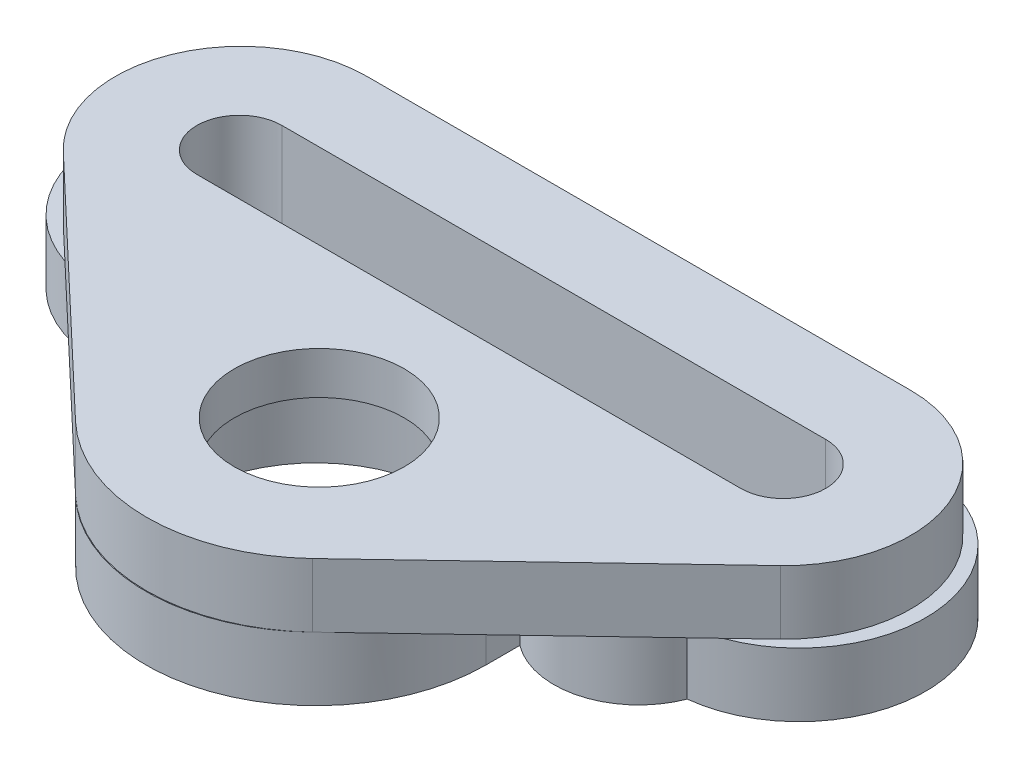
from build123d import *

# Parameters (mm, degrees)
SZKIC2_R                    = 7.5
SZKIC2_R_2                  = 2.4
DODANIE_WYCI_GNI_CIE1_DEPTH = 3.75
SZKIC3_R                    = 5
DODANIE_WYCI_GNI_CIE2_DEPTH = 3.75
SZKIC9_R                    = 7.5
WYTNIJ_WYCI_GNI_CIE3_DEPTH  = 5
SZKIC10_R                   = 2.5
WYTNIJ_WYCI_GNI_CIE4_DEPTH  = 6.5


with BuildPart() as part:
    # Szkic2 → Dodanie-wyciągnięcie1 (new body)
    with BuildSketch(Plane(origin=(0, 0, 0), x_dir=(1, 0, 0), z_dir=(0, 1, 0))):
        with BuildLine():
            Line((-16, 5), (16, 5))
            ThreePointArc((16, 5), (24.235849057, -1.575471698), (17.660377358, -9.811320755))
            ThreePointArc((17.660377358, -9.811320755), (14.373605639, -12.807619738), (10, -12))
            Line((10, -12), (10, -14))
            ThreePointArc((10, -14), (0, -24), (-10, -14))
            Line((-10, -14), (-10, -12.057627201))
            ThreePointArc((-10, -12.057627201), (-14.369651741, -12.856788302), (-17.67794965, -9.892386213))
            ThreePointArc((-17.67794965, -9.892386213), (-24.285167931, -1.607218282), (-16, 5))
        make_face()
        with Locations(Location((0, -14, 0), (0, 0, 270))):
            Circle(SZKIC2_R, mode=Mode.SUBTRACT)
        with Locations(Location((-13, -8, 0), (0, 0, 270))):
            Circle(SZKIC2_R_2, mode=Mode.SUBTRACT)
        with Locations(Location((13, -8, 0), (0, 0, 270))):
            Circle(SZKIC2_R_2, mode=Mode.SUBTRACT)
        with BuildLine():
            Line((-16, 0), (16, 0))
            ThreePointArc((16, 0), (18.5, -2.5), (16, -5))
            Line((16, -5), (-16, -5))
            ThreePointArc((-16, -5), (-18.5, -2.5), (-16, 0))
        make_face(mode=Mode.SUBTRACT)
    extrude(amount=DODANIE_WYCI_GNI_CIE1_DEPTH)

    # Szkic3 → Dodanie-wyciągnięcie2 (add)
    with BuildSketch(Plane(origin=(0, 3.75, 0), x_dir=(1, 0, 0), z_dir=(0, 1, 0))):
        with BuildLine():
            Line((-16, 5), (16, 5))
            ThreePointArc((16, 5), (22.873192437, 0.342120663), (21.093817027, -7.76777683))
            Line((21.093817027, -7.76777683), (6.968542539, -21.17212764))
            ThreePointArc((6.968542539, -21.17212764), (0, -23.952289066), (-6.968542539, -21.17212764))
            Line((-6.968542539, -21.17212764), (-21.093817027, -7.76777683))
            ThreePointArc((-21.093817027, -7.76777683), (-22.873192437, 0.342120663), (-16, 5))
        make_face()
        with Locations(Location((0, -13.8, 0), (0, 0, 270))):
            Circle(SZKIC3_R, mode=Mode.SUBTRACT)
        with BuildLine():
            Line((-16, 0), (16, 0))
            ThreePointArc((16, 0), (18.5, -2.5), (16, -5))
            Line((16, -5), (-16, -5))
            ThreePointArc((-16, -5), (-18.5, -2.5), (-16, 0))
        make_face(mode=Mode.SUBTRACT)
    extrude(amount=DODANIE_WYCI_GNI_CIE2_DEPTH)

    # Szkic9 → Wytnij-wyciągnięcie3 (cut)
    with BuildSketch(Plane.XZ):
        with Locations(Location((0, 14, 0), (0, 0, 270))):
            Circle(SZKIC9_R)
    extrude(amount=-WYTNIJ_WYCI_GNI_CIE3_DEPTH, mode=Mode.SUBTRACT)

    # Szkic10 → Wytnij-wyciągnięcie4 (cut)
    with BuildSketch(Plane.XZ):
        with Locations(Location((-13, 8, 0), (0, 0, 270))):
            Circle(SZKIC10_R)
        with Locations(Location((13, 8, 0), (0, 0, 270))):
            Circle(SZKIC10_R)
    extrude(amount=-WYTNIJ_WYCI_GNI_CIE4_DEPTH, mode=Mode.SUBTRACT)


solid = part.part
